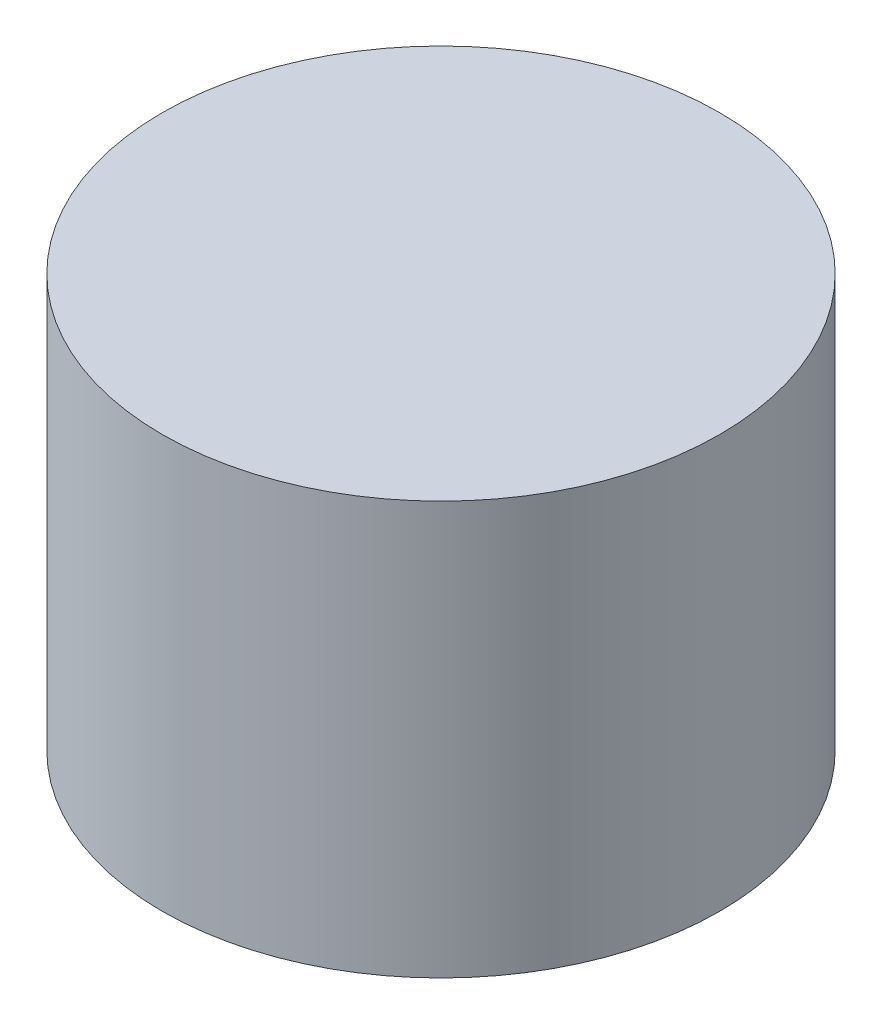
from build123d import *

# Parameters (mm, degrees)
SKETCH1_R           = 13.5
BOSS_EXTRUDE1_DEPTH = 20


with BuildPart() as part:
    # Sketch1 → Boss-Extrude1 (new body)
    with BuildSketch(Plane(origin=(0, 0, 0), x_dir=(1, 0, 0), z_dir=(0, 1, 0))):
        with Locations(Location((0, 0, 0), (0, 0, 270))):
            Circle(SKETCH1_R)
    extrude(amount=BOSS_EXTRUDE1_DEPTH)


solid = part.part
